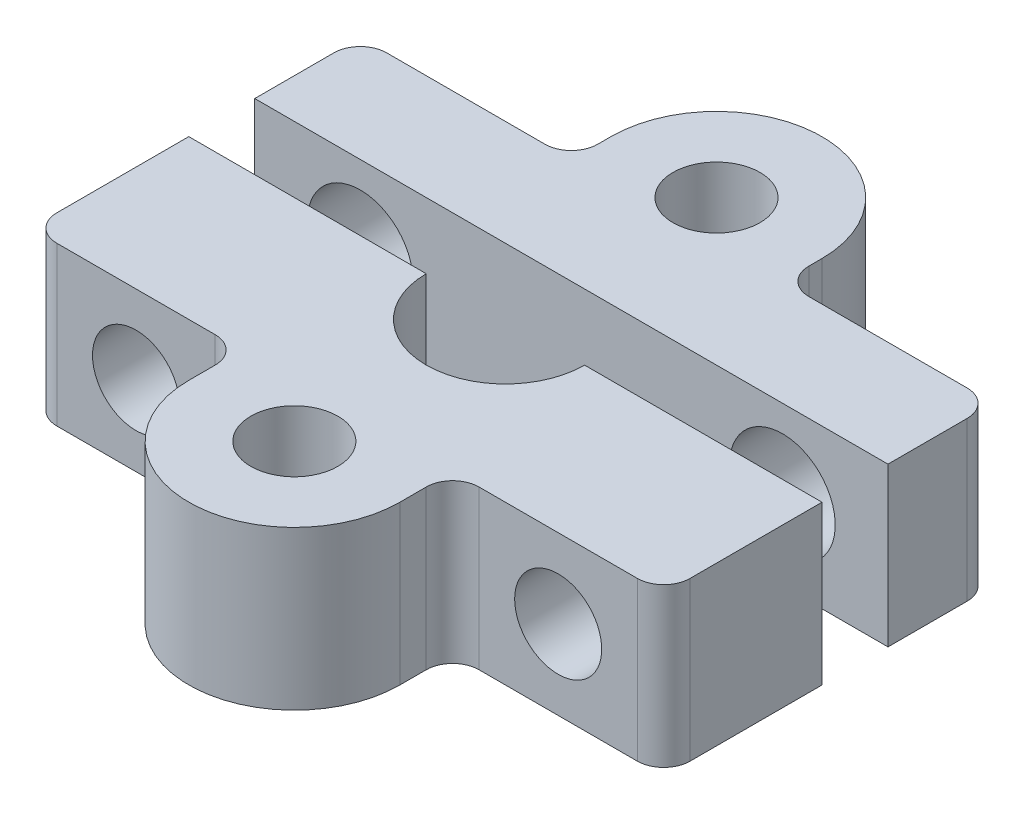
from build123d import *

# Parameters (mm, degrees)
EXTRUDE_1_DEPTH          = 6
EXTRUDE_1_2_DEPTH        = 6
CUT_EXTRUDE_2_DEPTH      = 19
CUT_EXTRUDE_2_DEPTH_BACK = 19
SKETCH_2_R               = 1.65
SKETCH_3_R               = 1.65
CUT_EXTRUDE_3_DEPTH      = 8
SKETCH_4_R               = 2
CUT_EXTRUDE_4_DEPTH      = 5


with BuildPart() as part:
    # 草图1 → 凸台-拉伸1 (new body)
    with BuildSketch(Plane(origin=(0, 0, 0), x_dir=(1, 0, 0), z_dir=(0, 1, 0))):
        with BuildLine():
            Line((-3, 0), (-12, 0))
            Line((-12, 0), (-12, -5))
            ThreePointArc((-12, -5), (-11.707106781, -5.707106781), (-11, -6))
            Line((-11, -6), (-5, -6))
            ThreePointArc((-5, -6), (-4.292893219, -6.292893219), (-4, -7))
            Line((-4, -7), (-4, -8))
            ThreePointArc((-4, -8), (0, -12), (4, -8))
            Line((4, -8), (4, -7))
            ThreePointArc((4, -7), (4.292893219, -6.292893219), (5, -6))
            Line((5, -6), (11, -6))
            ThreePointArc((11, -6), (11.707106781, -5.707106781), (12, -5))
            Line((12, -5), (12, 0))
            Line((12, 0), (3, 0))
            ThreePointArc((3, 0), (0, -3), (-3, 0))
        make_face()
    extrude(amount=EXTRUDE_1_DEPTH)


with BuildPart() as body_2:
    # 草图1 → Extrude 1 2 (new body)
    with BuildSketch(Plane(origin=(0, 0, 0), x_dir=(1, 0, 0), z_dir=(0, 1, 0))):
        with BuildLine():
            Line((12, 2.5), (-12, 2.5))
            Line((-12, 2.5), (-12, 5.5))
            ThreePointArc((-12, 5.5), (-11.707106781, 6.207106781), (-11, 6.5))
            Line((-11, 6.5), (-5, 6.5))
            ThreePointArc((-5, 6.5), (-4.292893219, 6.792893219), (-4, 7.5))
            Line((-4, 7.5), (-4, 8))
            ThreePointArc((-4, 8), (0, 12), (4, 8))
            Line((4, 8), (4, 7.5))
            ThreePointArc((4, 7.5), (4.292893219, 6.792893219), (5, 6.5))
            Line((5, 6.5), (11, 6.5))
            ThreePointArc((11, 6.5), (11.707106781, 6.207106781), (12, 5.5))
            Line((12, 5.5), (12, 2.5))
        make_face()
    extrude(amount=EXTRUDE_1_2_DEPTH)


with BuildPart() as cut_extrude_2_tool:
    # 草图2 → 切除-拉伸2 (new, two sides: drawn at the far end of the back side and taken through both)
    with BuildSketch(Plane(origin=(0, 0, 0), x_dir=(-1, 0, 0), z_dir=(0, 0, -1)).offset(-CUT_EXTRUDE_2_DEPTH_BACK)):
        with Locations((-8, 3)):
            Circle(SKETCH_2_R)
        with Locations((8, 3)):
            Circle(SKETCH_2_R)
    extrude(amount=CUT_EXTRUDE_2_DEPTH + CUT_EXTRUDE_2_DEPTH_BACK)


with BuildPart() as part_1:
    add(part.part)

    # 切除-拉伸2: cut by cut_extrude_2_tool
    add(cut_extrude_2_tool.part, mode=Mode.SUBTRACT)


with BuildPart() as body_2_1:
    add(body_2.part)

    # 切除-拉伸2: cut by cut_extrude_2_tool
    add(cut_extrude_2_tool.part, mode=Mode.SUBTRACT)


with BuildPart() as cut_extrude_3_tool:
    # 草图3 → 切除-拉伸3 (new body)
    with BuildSketch(Plane.XZ):
        with Locations(Location((0, 8, 0), (0, 0, 270))):
            Circle(SKETCH_3_R)
        with Locations(Location((0, -8, 0), (0, 0, 270))):
            Circle(SKETCH_3_R)
    extrude(amount=-CUT_EXTRUDE_3_DEPTH)


with BuildPart() as part_2:
    add(part_1.part)

    # 切除-拉伸3: cut by cut_extrude_3_tool
    add(cut_extrude_3_tool.part, mode=Mode.SUBTRACT)


with BuildPart() as body_2_2:
    add(body_2_1.part)

    # 切除-拉伸3: cut by cut_extrude_3_tool
    add(cut_extrude_3_tool.part, mode=Mode.SUBTRACT)

    # 草图4 → 切除-拉伸4 (cut)
    with BuildSketch(Plane(origin=(0, 0, -6.5), x_dir=(-1, 0, 0), z_dir=(0, 0, -1))):
        with Locations((-8, 3)):
            Circle(SKETCH_4_R)
        with Locations((8, 3)):
            Circle(SKETCH_4_R)
    extrude(amount=-CUT_EXTRUDE_4_DEPTH, mode=Mode.SUBTRACT)


solid = Compound([part_2.part, body_2_2.part])
